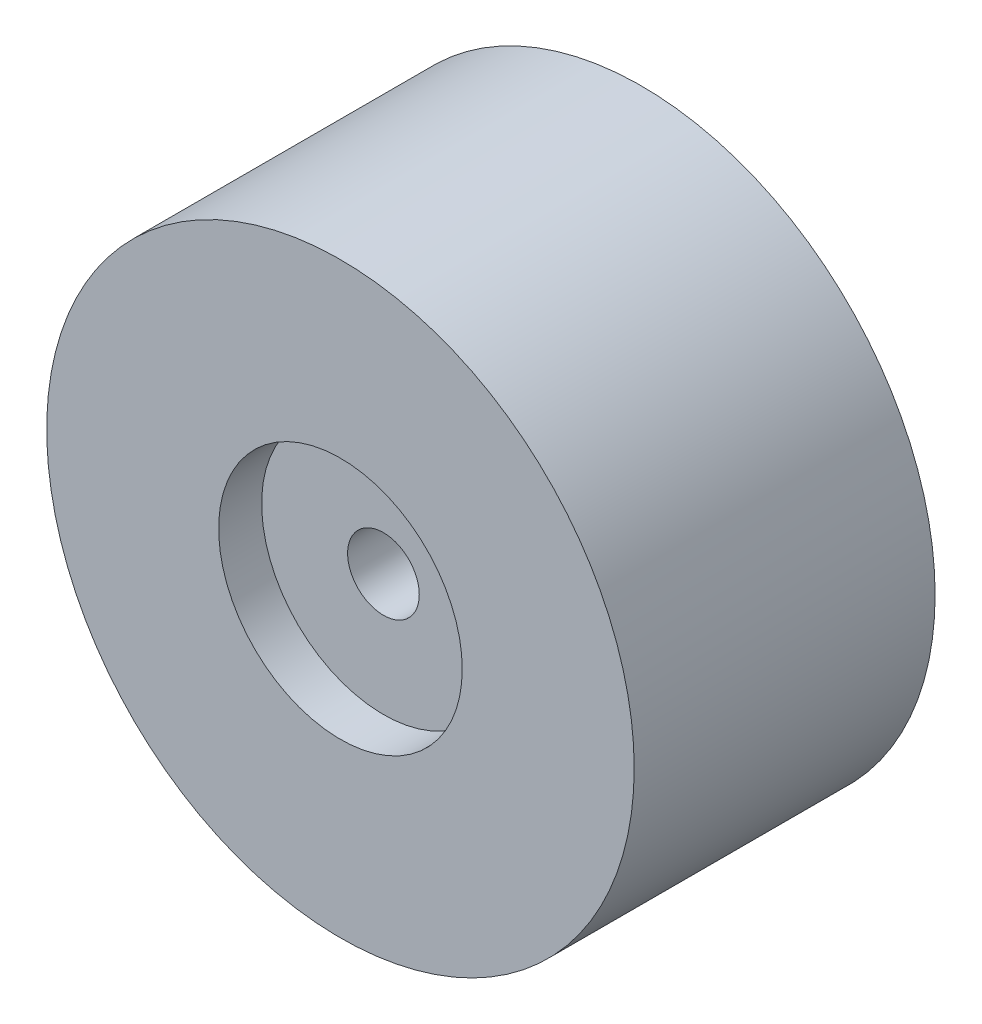
from build123d import *

# Parameters (mm, degrees)
SKETCH_1_R      = 10.25
SKETCH_1_R_2    = 1.25
EXTRUDE_1_DEPTH = 9
SKETCH_2_R      = 10.25
SKETCH_2_R_2    = 4.25
EXTRUDE_2_DEPTH = 1.5


with BuildPart() as part:
    # 草圖1 → 填料-伸長1 (new body)
    with BuildSketch(Plane.XY):
        Circle(SKETCH_1_R)
        Circle(SKETCH_1_R_2, mode=Mode.SUBTRACT)
    extrude(amount=EXTRUDE_1_DEPTH)

    # 草圖2 → 填料-伸長2 (add)
    with BuildSketch(Plane.XY.offset(9)):
        Circle(SKETCH_2_R)
        Circle(SKETCH_2_R_2, mode=Mode.SUBTRACT)
    extrude(amount=EXTRUDE_2_DEPTH)


solid = part.part
